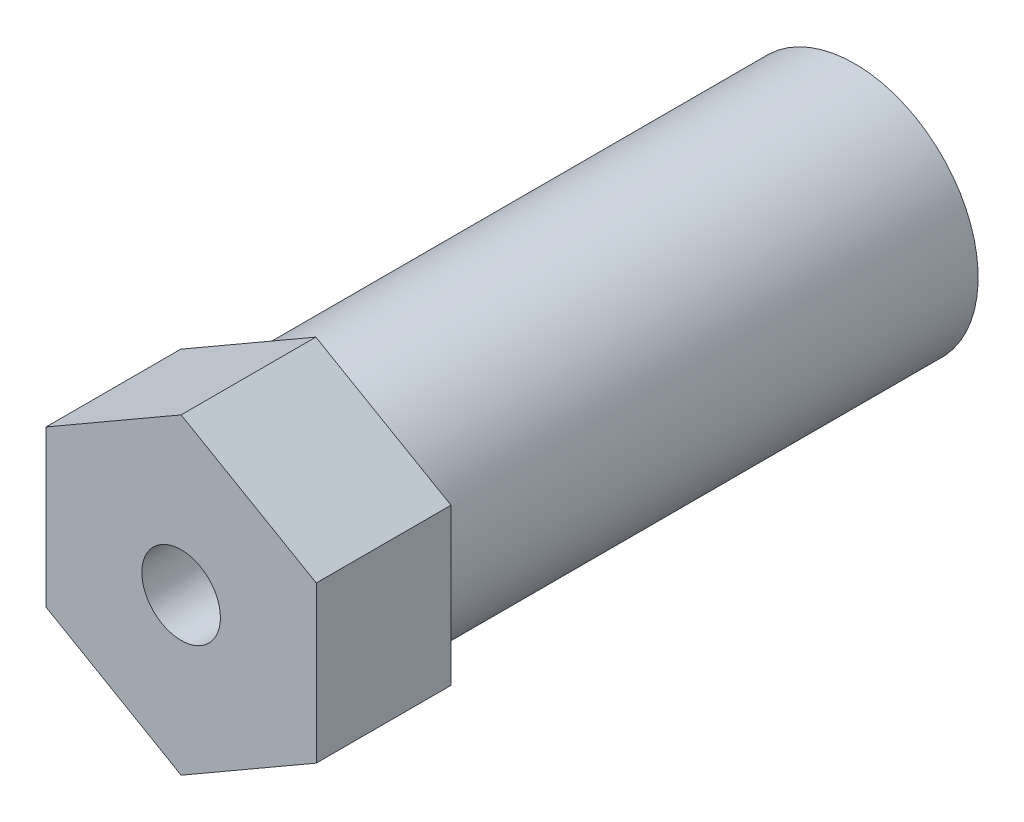
from build123d import *

# Parameters (mm, degrees)
BOSS_EXTRUDE1_DEPTH = 6
SKETCH3_R           = 1.75
CUT_EXTRUDE1_DEPTH  = 6
SKETCH4_R           = 5.5
SKETCH4_R_2         = 3
BOSS_EXTRUDE2_DEPTH = 24


with BuildPart() as part:
    # Sketch2 → Boss-Extrude1 (new body)
    with BuildSketch(Plane.XY):
        Polygon((0, 6.95), (-6.018876556, 3.475), (-6.018876556, -3.475), (0, -6.95), (6.018876556, -3.475), (6.018876556, 3.475), align=None)
    extrude(amount=BOSS_EXTRUDE1_DEPTH)

    # Sketch3 → Cut-Extrude1 (cut)
    with BuildSketch(Plane.XY.offset(6)):
        Circle(SKETCH3_R)
    extrude(amount=-CUT_EXTRUDE1_DEPTH, mode=Mode.SUBTRACT)

    # Sketch4 → Boss-Extrude2 (add)
    with BuildSketch(Plane(origin=(0, 0, 0), x_dir=(-1, 0, 0), z_dir=(0, 0, -1))):
        Circle(SKETCH4_R)
        Circle(SKETCH4_R_2, mode=Mode.SUBTRACT)
    extrude(amount=BOSS_EXTRUDE2_DEPTH)


solid = part.part
